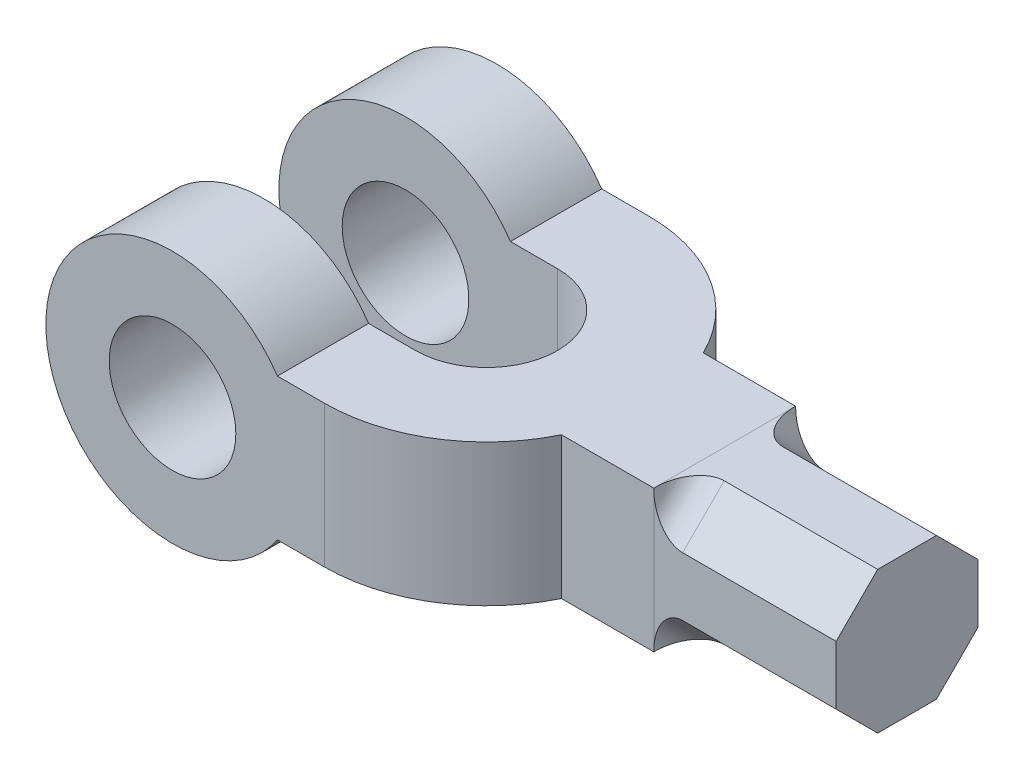
from build123d import *

# Parameters (mm, degrees)
CROQUIS1_R              = 12.5
SALIENTE_EXTRUIR2_DEPTH = 32
CROQUIS3_W              = 110
CROQUIS3_H              = 28
CORTAR_EXTRUIR1_DEPTH   = 32
SALIENTE_EXTRUIR3_DEPTH = 28
CROQUIS9_W              = 30
CROQUIS9_H              = 28
SALIENTE_EXTRUIR4_DEPTH = 14
SALIENTE_EXTRUIR5_DEPTH = 36
REDONDEO2_R             = 5.7


with BuildPart() as part:
    # Croquis1 → Saliente-Extruir2 (new, symmetric)
    with BuildSketch(Plane.XY):
        with BuildLine():
            Line((20.712315177, -14), (30, -14))
            Line((30, -14), (30, 14))
            Line((30, 14), (20.712315177, 14))
            ThreePointArc((20.712315177, 14), (-25, 0), (20.712315177, -14))
        make_face()
        Circle(CROQUIS1_R, mode=Mode.SUBTRACT)
    extrude(amount=SALIENTE_EXTRUIR2_DEPTH, both=True)

    # Croquis3 → Cortar-Extruir1 (cut, symmetric)
    with BuildSketch(Plane(origin=(0, 0, 0), x_dir=(1, 0, 0), z_dir=(0, 1, 0))):
        with Locations((-25, 0)):
            Rectangle(CROQUIS3_W, CROQUIS3_H)
    extrude(amount=CORTAR_EXTRUIR1_DEPTH, both=True, mode=Mode.SUBTRACT)


with BuildPart() as cortar_extruir1_piece_1:
    # of the separate pieces the step leaves, piece 1, a body of its own (cortar_extruir1_pieces)
    add(part.part.solids().sort_by_distance((20.712315177, -14, -14))[0])



with BuildPart() as cortar_extruir1_piece_2:
    # of the separate pieces the step leaves, piece 2, a body of its own (cortar_extruir1_pieces)
    add(part.part.solids().sort_by_distance((20.712315177, -14, 32))[0])


with BuildPart() as cortar_extruir1_piece_1_1:
    add(cortar_extruir1_piece_1.part)

    add(cortar_extruir1_piece_2.part)  # Saliente-Extruir3 merges Cortar-Extruir1 piece 2
    # Croquis7 → Saliente-Extruir3 (add)
    with BuildSketch(Plane(origin=(0, 14, 0), x_dir=(1, 0, 0), z_dir=(0, 1, 0))):
        with BuildLine():
            Line((30, 32), (30, 14))
            ThreePointArc((30, 14), (44, 0), (30, -14))
            Line((30, -14), (30, -32))
            ThreePointArc((30, -32), (62, 0), (30, 32))
        make_face()
    extrude(amount=-SALIENTE_EXTRUIR3_DEPTH)

    # Croquis9 → Saliente-Extruir4 (add, symmetric)
    with BuildSketch(Plane(origin=(0, 0, 0), x_dir=(1, 0, 0), z_dir=(0, 1, 0))):
        with Locations((62, 0)):
            Rectangle(CROQUIS9_W, CROQUIS9_H)
    extrude(amount=SALIENTE_EXTRUIR4_DEPTH, both=True)

    # Croquis10 → Saliente-Extruir5 (add)
    with BuildSketch(Plane(origin=(77, 0, 0), x_dir=(0, 0, -1), z_dir=(1, 0, 0))):
        Polygon((-14.00015584, 5.798613627), (-13.99984415, -5.799366115), (-5.798613627, -14.00015584), (5.799366115, -13.99984415), (14.00015584, -5.798613627), (13.99984415, 5.799366115), (5.798613627, 14.00015584), (-5.799366115, 13.99984415), align=None)
    extrude(amount=SALIENTE_EXTRUIR5_DEPTH)

    # Redondeo2
    redondeo2_edges = [cortar_extruir1_piece_1_1.edges().sort_by_distance(p)[0] for p in [
        (77, -9.899683057, 9.899306813),
        (77, -9.899306813, -9.899683057),
        (77, 9.899683057, -9.899306813),
        (77, 9.899306813, 9.899683057),
    ]]
    fillet(redondeo2_edges, radius=REDONDEO2_R)


solid = cortar_extruir1_piece_1_1.part
